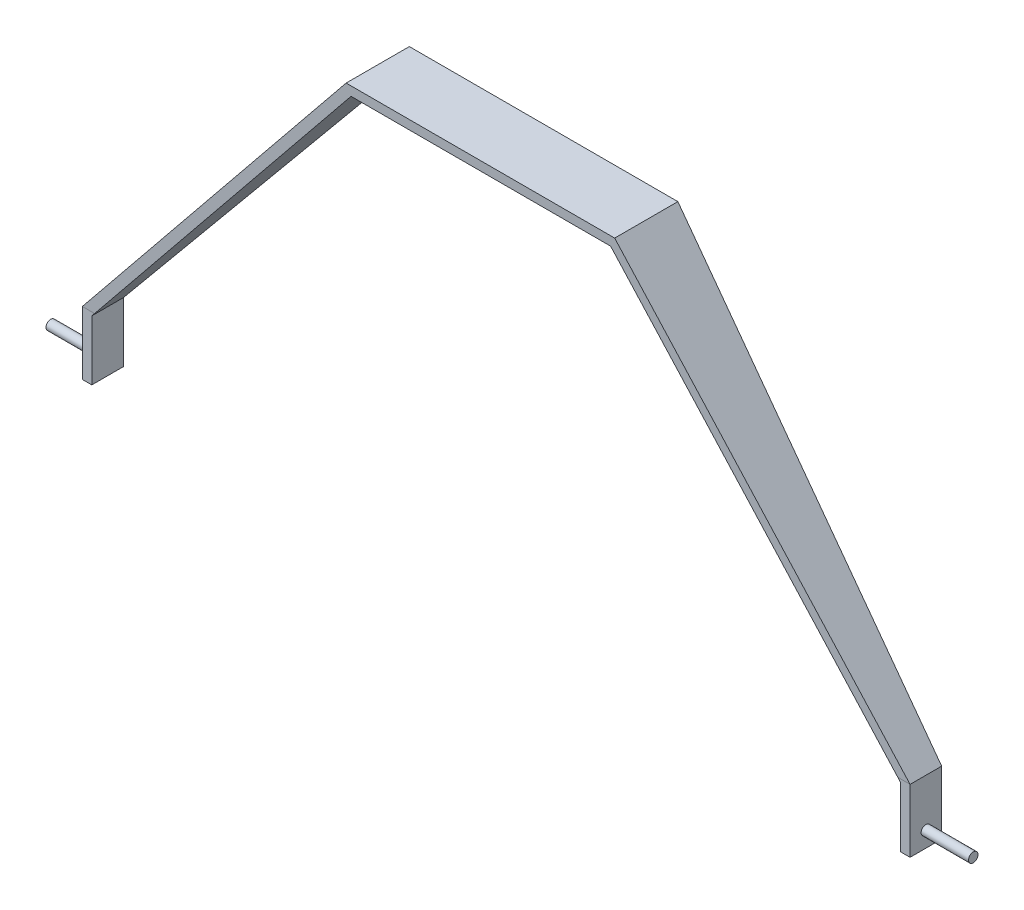
from build123d import *

# Parameters (mm, degrees)
BOSS_EXTRUDE1_DEPTH = 20
SKETCH6_W           = 5
SKETCH6_H           = 20
CUT_EXTRUDE1_DEPTH  = 293.280687012
SKETCH7_R           = 1.5
BOSS_EXTRUDE2_DEPTH = 15
BOSS_EXTRUDE3_START = 15
SKETCH8_R           = 1.5
BOSS_EXTRUDE3_DEPTH = 15


with BuildPart() as part:
    # Sketch5 → Boss-Extrude1 (new body)
    with BuildSketch(Plane.XY):
        Polygon((0, 0), (-42.5, 0), (-131, -108), (-131, -128), (-128, -128), (-128, -109.072168564), (-41.07975076, -3), (0, -3), align=None)
        Polygon((42.5, 0), (0, 0), (0, -3), (41.07975076, -3), (128, -109.072168564), (128, -128), (131, -128), (131, -108), align=None)
    extrude(amount=BOSS_EXTRUDE1_DEPTH)

    # Sketch6 → Cut-Extrude1 (cut, through all)
    with BuildSketch(Plane(origin=(131, 0, 0), x_dir=(0, 0, -1), z_dir=(1, 0, 0))):
        with Locations((-17.5, -118)):
            Rectangle(SKETCH6_W, SKETCH6_H)
        Polygon((-20, -108), (-15, -108), (-20, 0), align=None)
        Polygon((0, 0), (-5, -108), (0, -108), align=None)
        with Locations((-2.5, -118)):
            Rectangle(SKETCH6_W, SKETCH6_H)
    extrude(amount=-CUT_EXTRUDE1_DEPTH, mode=Mode.SUBTRACT)

    # Sketch7 → Boss-Extrude2 (add)
    with BuildSketch(Plane(origin=(131, 0, 0), x_dir=(0, 0, -1), z_dir=(1, 0, 0))):
        with Locations((-10, -123)):
            Circle(SKETCH7_R)
    extrude(amount=BOSS_EXTRUDE2_DEPTH)

    # Sketch8 → Boss-Extrude3 (add)
    with BuildSketch(Plane.ZY.offset(131).offset(BOSS_EXTRUDE3_START)):
        with Locations(Location((10, -123, 0), (0, 0, 180))):
            Circle(SKETCH8_R)
    extrude(amount=-BOSS_EXTRUDE3_DEPTH)


solid = part.part
